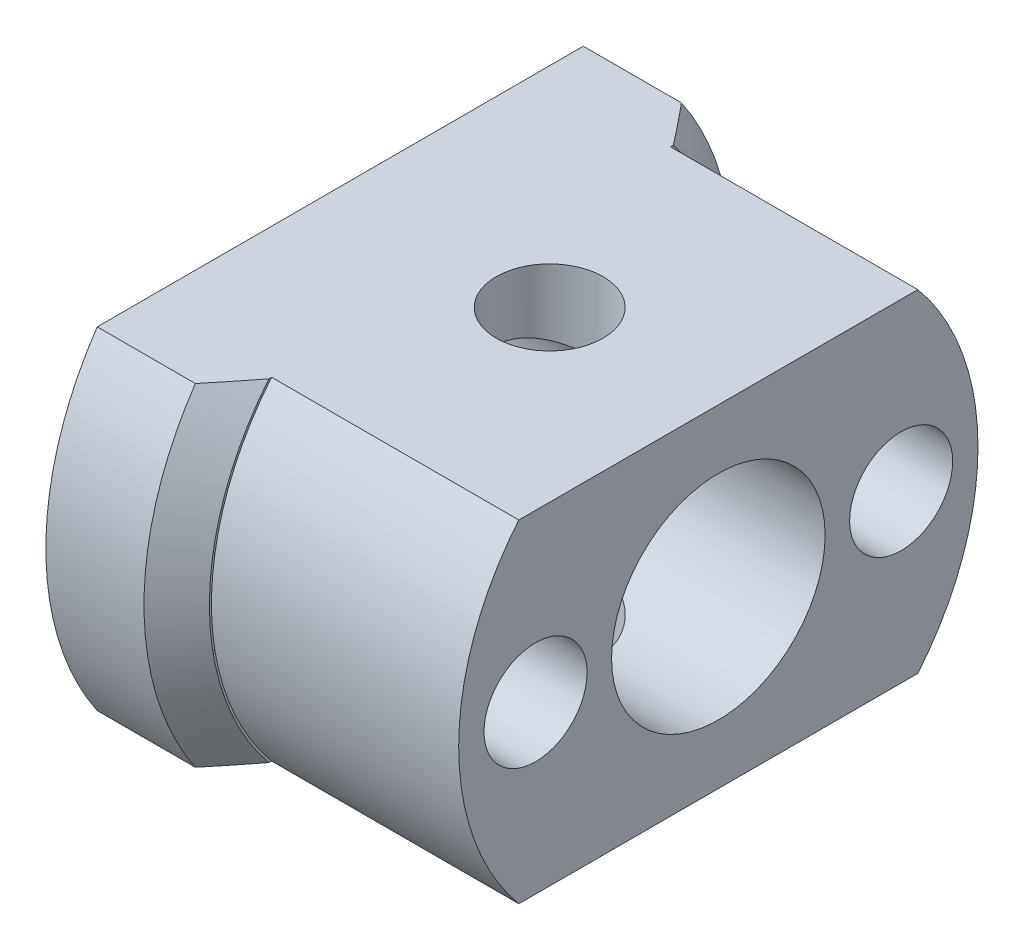
from build123d import *

# Parameters (mm, degrees)
SKETCH1_R                 = 7.9375
SKETCH1_R_2               = 1.575
SKETCH1_R_3               = 3.2639
INNER_SIDE_EXTRUDE_DEPTH  = 2.032
OUTER_START               = -9.525
SKETCH1_3_R               = 7.9375
SKETCH1_3_R_2             = 1.575
SKETCH1_3_R_3             = 3.2639
OUTER_SIDE_EXTRUDE_DEPTH  = 9.525
CLEVIS_PIN_CUT_DEPTH      = 15.721869362
CLEVIS_PIN_CUT_DEPTH_BACK = 15.721869362
SKETCH2_R                 = 1.63195
SKETCH3_R                 = 9
SKETCH3_R_2               = 7.9375
BOSS_EXTRUDE1_DEPTH       = 4
SKETCH4_R                 = 1.575
CUT_EXTRUDE1_DEPTH        = 4
CHAMFER1_SIZE             = 1
CUT_EXTRUDE2_DEPTH        = 16.897346537
CUT_EXTRUDE2_DEPTH_BACK   = 16.897346537
SKETCH5_W                 = 16.51
SKETCH5_H                 = 4.312866645


with BuildPart() as part:
    # Sketch1 → Inner Side Extrude (new body)
    with BuildSketch(Plane(origin=(0, 0, 0), x_dir=(0, 0, -1), z_dir=(1, 0, 0))):
        Circle(SKETCH1_R)
        with Locations((5.588, 0)):
            Circle(SKETCH1_R_2, mode=Mode.SUBTRACT)
        with Locations((-5.588, 0)):
            Circle(SKETCH1_R_2, mode=Mode.SUBTRACT)
        Circle(SKETCH1_R_3, mode=Mode.SUBTRACT)
    extrude(amount=INNER_SIDE_EXTRUDE_DEPTH)

    # Sketch1<3> → Outer Side Extrude (add)
    with BuildSketch(Plane(origin=(0, 0, 0), x_dir=(0, 0, -1), z_dir=(1, 0, 0)).offset(OUTER_START)):
        Circle(SKETCH1_3_R)
        with Locations((5.588, 0)):
            Circle(SKETCH1_3_R_2, mode=Mode.SUBTRACT)
        with Locations((-5.588, 0)):
            Circle(SKETCH1_3_R_2, mode=Mode.SUBTRACT)
        Circle(SKETCH1_3_R_3, mode=Mode.SUBTRACT)
    extrude(amount=OUTER_SIDE_EXTRUDE_DEPTH)

    # Sketch2 → Clevis Pin Cut (cut, two sides: drawn at the far end of the back side and taken through both)
    with BuildSketch(Plane(origin=(0, 0, 0), x_dir=(1, 0, 0), z_dir=(0, 1, 0)).offset(-CLEVIS_PIN_CUT_DEPTH_BACK)):
        with Locations((-3.1242, 0)):
            Circle(SKETCH2_R)
    extrude(amount=CLEVIS_PIN_CUT_DEPTH + CLEVIS_PIN_CUT_DEPTH_BACK, mode=Mode.SUBTRACT)

    # Sketch3 → Boss-Extrude1 (add)
    with BuildSketch(Plane(origin=(-9.525, 0, 0), x_dir=(0, 0, -1), z_dir=(1, 0, 0))):
        Circle(SKETCH3_R)
        Circle(SKETCH3_R_2, mode=Mode.SUBTRACT)
    extrude(amount=BOSS_EXTRUDE1_DEPTH)

    # Sketch4 → Cut-Extrude1 (cut)
    # profile 1 of 2: a face of its own
    with BuildSketch(Plane(origin=(-9.525, 0, 0), x_dir=(0, 0, -1), z_dir=(1, 0, 0))):
        Polygon((-3.338, 1.299038106), (-5.588, 2.598076211), (-7.838, 1.299038106), (-7.838, -1.299038106), (-5.588, -2.598076211), (-3.338, -1.299038106), align=None)
        with Locations((-5.588, 0)):
            Circle(SKETCH4_R, mode=Mode.SUBTRACT)
    # profile 2 of 2: a face of its own
    with BuildSketch(Plane(origin=(-9.525, 0, 0), x_dir=(0, 0, -1), z_dir=(1, 0, 0))):
        Polygon((5.588, 2.598076211), (3.338, 1.299038106), (3.338, -1.299038106), (5.588, -2.598076211), (7.838, -1.299038106), (7.838, 1.299038106), align=None)
        with Locations((5.588, 0)):
            Circle(SKETCH4_R, mode=Mode.SUBTRACT)
    extrude(amount=CUT_EXTRUDE1_DEPTH, mode=Mode.SUBTRACT)

    # Chamfer1
    chamfer1_edges = [part.edges().sort_by_distance(p)[0] for p in [
        (-5.525, 0, 9),
    ]]
    chamfer(chamfer1_edges, length=CHAMFER1_SIZE)

    # Sketch5 → Cut-Extrude2 (cut, two sides: drawn at the far end of the back side and taken through both)
    with BuildSketch(Plane.XY.offset(-CUT_EXTRUDE2_DEPTH_BACK)):
        with Locations((-3.1242, 7.236433322)):
            Rectangle(SKETCH5_W, SKETCH5_H)
        with Locations((-3.1242, -7.236433322)):
            Rectangle(SKETCH5_W, SKETCH5_H)
    extrude(amount=CUT_EXTRUDE2_DEPTH + CUT_EXTRUDE2_DEPTH_BACK, mode=Mode.SUBTRACT)


solid = part.part
